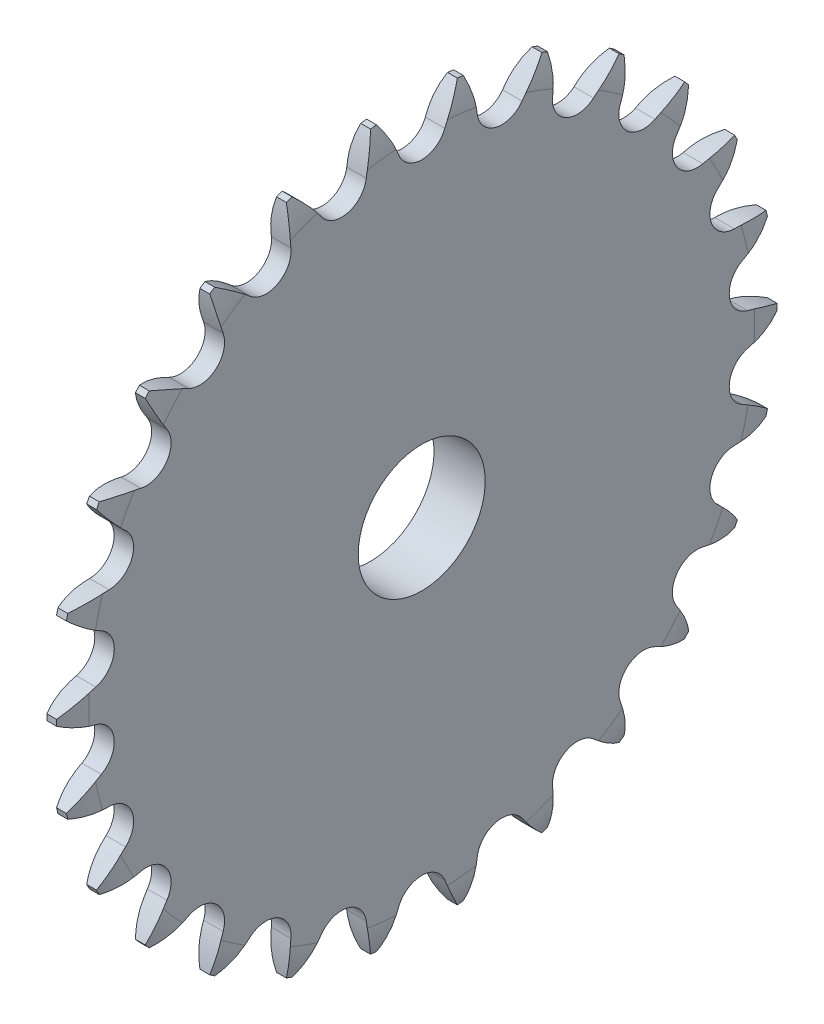
from build123d import *

# Parameters (mm, degrees)
TOOTHCUT_DEPTH     = 81.306175466
TEETHCUTS_COUNT    = 26
TEETHCUTS_ANGLE    = 346.153846154
HUBNEAONESKE_R     = 21
HUBNEARONE_DEPTH   = 5
HUBNEARONEFILLET_R = 0.6
BORSKE_R           = 10
BORE_DEPTH         = 25.0005


with BuildPart() as part:
    # BasProSke → Base-Revolve (revolve)
    with BuildSketch(Plane(origin=(0, 0, 0), x_dir=(1, 0, 0), z_dir=(0, 1, 0)), mode=Mode.PRIVATE) as base_revolve_sk:
        with BuildLine():
            Line((0, 0), (0, 52.410643941))
            ThreePointArc((0, 52.410643941), (0.191950592, 54.610348467), (0.762, 56.743559357))
            Line((0.762, 56.743559357), (2.307, 56.743559357))
            ThreePointArc((2.307, 56.743559357), (2.877049408, 54.610348467), (3.069, 52.410643941))
            Line((3.069, 52.410643941), (3.069, 0))
            Line((3.069, 0), (0, 0))
        make_face()
    revolve(base_revolve_sk.sketch.rotate(Axis((-10, 0, 0), (1, 0, 0)), 180), axis=Axis((-10, 0, 0), (1, 0, 0)))

    # TooCutSke → ToothCut (cut, through all)
    with BuildSketch(Plane(origin=(0, 0, 0), x_dir=(0, 0, -1), z_dir=(1, 0, 0))):
        with BuildLine():
            ThreePointArc((3.635614951, 51.270760363), (4.995081237, 54.154497716), (6.696756898, 56.850492829))
            ThreePointArc((6.696756898, 56.850492829), (0, 57.243559357), (-6.696756898, 56.850492829))
            ThreePointArc((-6.696756898, 56.850492829), (-4.995081237, 54.154497716), (-3.635614951, 51.270760363))
            ThreePointArc((-3.635614951, 51.270760363), (0, 48.806059357), (3.635614951, 51.270760363))
        make_face()
    toothcut = extrude(amount=TOOTHCUT_DEPTH, mode=Mode.SUBTRACT)

    # TeethCuts: ToothCut ×26 about axis
    teethcuts_axis = Axis((-10, 0, 0), (1, 0, 0))
    for i in range(1, TEETHCUTS_COUNT):
        add(toothcut.rotate(teethcuts_axis, i * TEETHCUTS_ANGLE / (TEETHCUTS_COUNT - 1)), mode=Mode.SUBTRACT)

    # HubNeaOneSke → HubNearOne (add)
    with BuildSketch(Plane.ZY):
        with Locations(Location((0, 0, 0), (0, 0, 180))):
            Circle(HUBNEAONESKE_R)
    extrude(amount=HUBNEARONE_DEPTH)

    # HubNearOneFillet
    hubnearonefillet_edges = [part.edges().sort_by_distance(p)[0] for p in [
        (0, 0, 21),
    ]]
    fillet(hubnearonefillet_edges, radius=HUBNEARONEFILLET_R)

    # BorSke → Bore (cut, symmetric)
    with BuildSketch(Plane(origin=(0, 0, 0), x_dir=(0, 0, -1), z_dir=(1, 0, 0))):
        with Locations(Location((0, 0, 0), (0, 0, 180))):
            Circle(BORSKE_R)
    extrude(amount=BORE_DEPTH, both=True, mode=Mode.SUBTRACT)


solid = part.part
